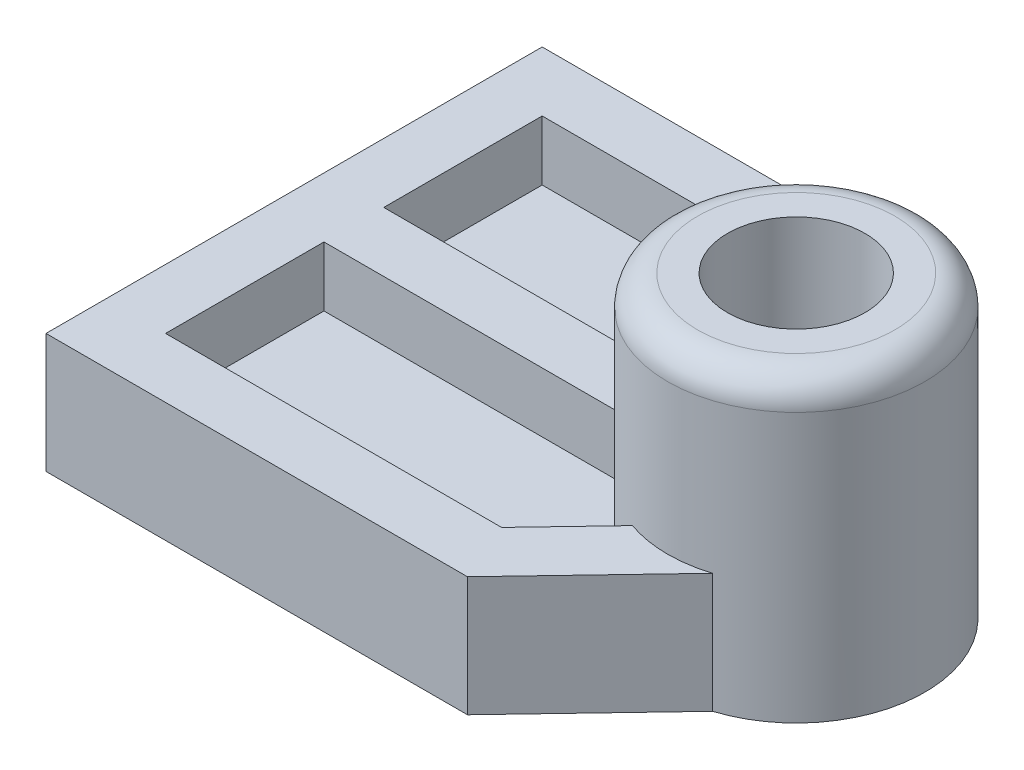
from build123d import *

# Parameters (mm, degrees)
SKETCH1_W           = 10.5
SKETCH1_H           = 8.3
BOSS_EXTRUDE1_DEPTH = 5
CUT_EXTRUDE1_DEPTH  = 10
SKETCH3_W           = 8.3
SKETCH3_H           = 5
BOSS_EXTRUDE2_DEPTH = 0.05
CUT_EXTRUDE2_DEPTH  = 3
SKETCH5_R           = 1.15
CUT_EXTRUDE3_DEPTH  = 5
CUT_EXTRUDE4_DEPTH  = 1
FILLET1_R           = 0.5


with BuildPart() as part:
    # Sketch1 → Boss-Extrude1 (new body)
    with BuildSketch(Plane(origin=(0, 0, 0), x_dir=(1, 0, 0), z_dir=(0, 1, 0))):
        Rectangle(SKETCH1_W, SKETCH1_H)
    extrude(amount=BOSS_EXTRUDE1_DEPTH)

    # Sketch2 → Cut-Extrude1 (cut)
    with BuildSketch(Plane(origin=(0, 5, 0), x_dir=(1, 0, 0), z_dir=(0, 1, 0))):
        with BuildLine():
            Line((1.75, 4.15), (3.75, 2.049390153))
            ThreePointArc((3.75, 2.049390153), (4.834935157, 1.26984251), (5.25, 0))
            Line((5.25, 0), (5.25, 4.15))
            Line((5.25, 4.15), (1.75, 4.15))
        make_face()
        with BuildLine():
            Line((3.75, -2.049390153), (1.75, -4.15))
            Line((1.75, -4.15), (3.75, -4.15))
            Line((3.75, -4.15), (5.25, -4.15))
            Line((5.25, -4.15), (5.25, 0))
            ThreePointArc((5.25, 0), (4.834935157, -1.26984251), (3.75, -2.049390153))
        make_face()
    extrude(amount=-CUT_EXTRUDE1_DEPTH, mode=Mode.SUBTRACT)

    # Sketch3 → Boss-Extrude2 (add)
    with BuildSketch(Plane.ZY.offset(5.25)):
        with Locations((0, 2.5)):
            Rectangle(SKETCH3_W, SKETCH3_H)
    extrude(amount=BOSS_EXTRUDE2_DEPTH)

    # Sketch4 → Cut-Extrude2 (cut)
    with BuildSketch(Plane(origin=(0, 5, 0), x_dir=(1, 0, 0), z_dir=(0, 1, 0))):
        with BuildLine():
            ThreePointArc((3.75, -2.049390153), (0.95, 0), (3.75, 2.049390153))
            Line((3.75, 2.049390153), (1.75, 4.15))
            Line((1.75, 4.15), (-5.3, 4.15))
            Line((-5.3, 4.15), (-5.3, -4.15))
            Line((-5.3, -4.15), (1.75, -4.15))
            Line((1.75, -4.15), (3.75, -2.049390153))
        make_face()
    extrude(amount=-CUT_EXTRUDE2_DEPTH, mode=Mode.SUBTRACT)

    # Sketch5 → Cut-Extrude3 (cut)
    with BuildSketch(Plane(origin=(0, 5, 0), x_dir=(1, 0, 0), z_dir=(0, 1, 0))):
        with Locations(Location((3.1, 0, 0), (0, 0, 270))):
            Circle(SKETCH5_R)
    extrude(amount=-CUT_EXTRUDE3_DEPTH, mode=Mode.SUBTRACT)

    # Sketch6 → Cut-Extrude4 (cut)
    with BuildSketch(Plane(origin=(0, 2, 0), x_dir=(1, 0, 0), z_dir=(0, 1, 0))):
        with BuildLine():
            Line((1.321758158, 3.15), (-4.3, 3.15))
            Line((-4.3, 3.15), (-4.3, 0.5))
            Line((-4.3, 0.5), (-1.21237994, 0.5))
            Line((-1.21237994, 0.5), (1.008947633, 0.5))
            ThreePointArc((1.008947633, 0.5), (1.503963979, 1.440544696), (2.389026153, 2.029043171))
            Line((2.389026153, 2.029043171), (1.321758158, 3.15))
        make_face()
        with BuildLine():
            Line((-1.21237994, -0.5), (-4.3, -0.5))
            Line((-4.3, -0.5), (-4.3, -3.15))
            Line((-4.3, -3.15), (1.321758158, -3.15))
            Line((1.321758158, -3.15), (2.389026153, -2.029043171))
            ThreePointArc((2.389026153, -2.029043171), (1.503963979, -1.440544696), (1.008947633, -0.5))
            Line((1.008947633, -0.5), (-1.21237994, -0.5))
        make_face()
    extrude(amount=-CUT_EXTRUDE4_DEPTH, mode=Mode.SUBTRACT)

    # Fillet1
    fillet1_edges = [part.edges().sort_by_distance(p)[0] for p in [
        (2.45, 5, 2.049390153),
    ]]
    fillet(fillet1_edges, radius=FILLET1_R)


solid = part.part
